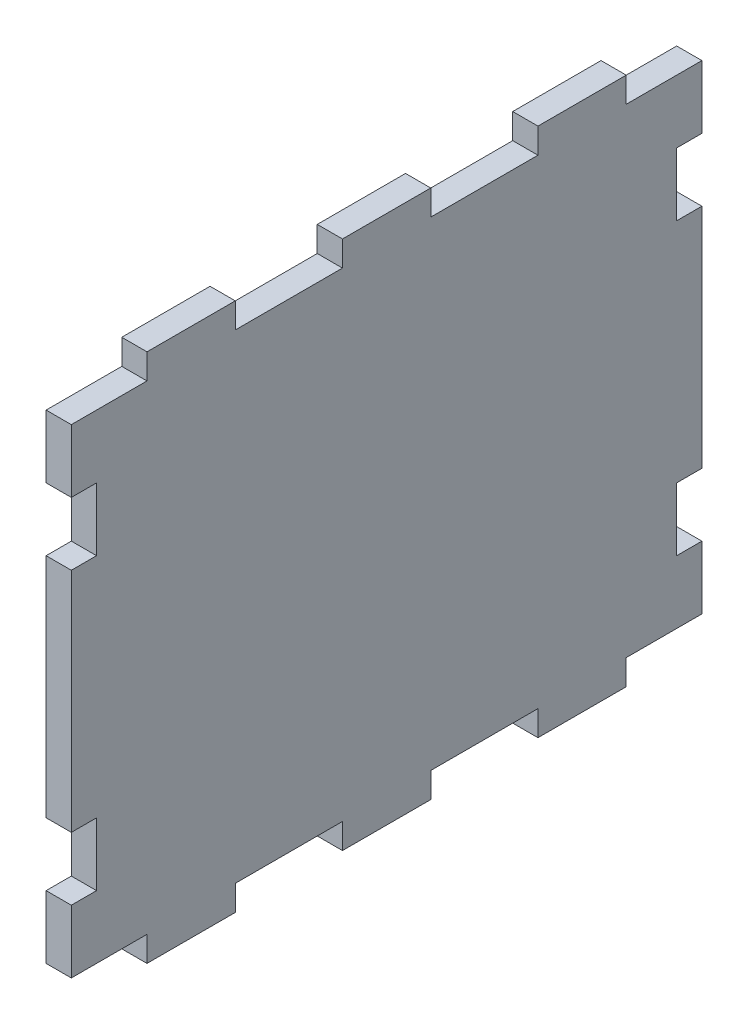
from build123d import *

# Parameters (mm, degrees)
BOSS_EXTRUDE1_DEPTH = 2


with BuildPart() as part:
    # Sketch1 → Boss-Extrude1 (new body)
    with BuildSketch(Plane(origin=(0, 0, 0), x_dir=(0, 0, -1), z_dir=(1, 0, 0))):
        Polygon((-19, 19), (-25, 19), (-25, 14), (-23, 14), (-23, 9), (-25, 9), (-25, -9), (-23, -9), (-23, -14), (-25, -14), (-25, -19), (-19, -19), (-19, -21), (-12, -21), (-12, -19), (-3.5, -19), (-3.5, -21), (3.5, -21), (3.5, -19), (12, -19), (12, -21), (19, -21), (19, -19), (25, -19), (25, -14), (23, -14), (23, -9), (25, -9), (25, 9), (23, 9), (23, 14), (25, 14), (25, 19), (19, 19), (19, 21), (12, 21), (12, 19), (3.5, 19), (3.5, 21), (-3.5, 21), (-3.5, 19), (-12, 19), (-12, 21), (-19, 21), align=None)
    extrude(amount=BOSS_EXTRUDE1_DEPTH)


solid = part.part
